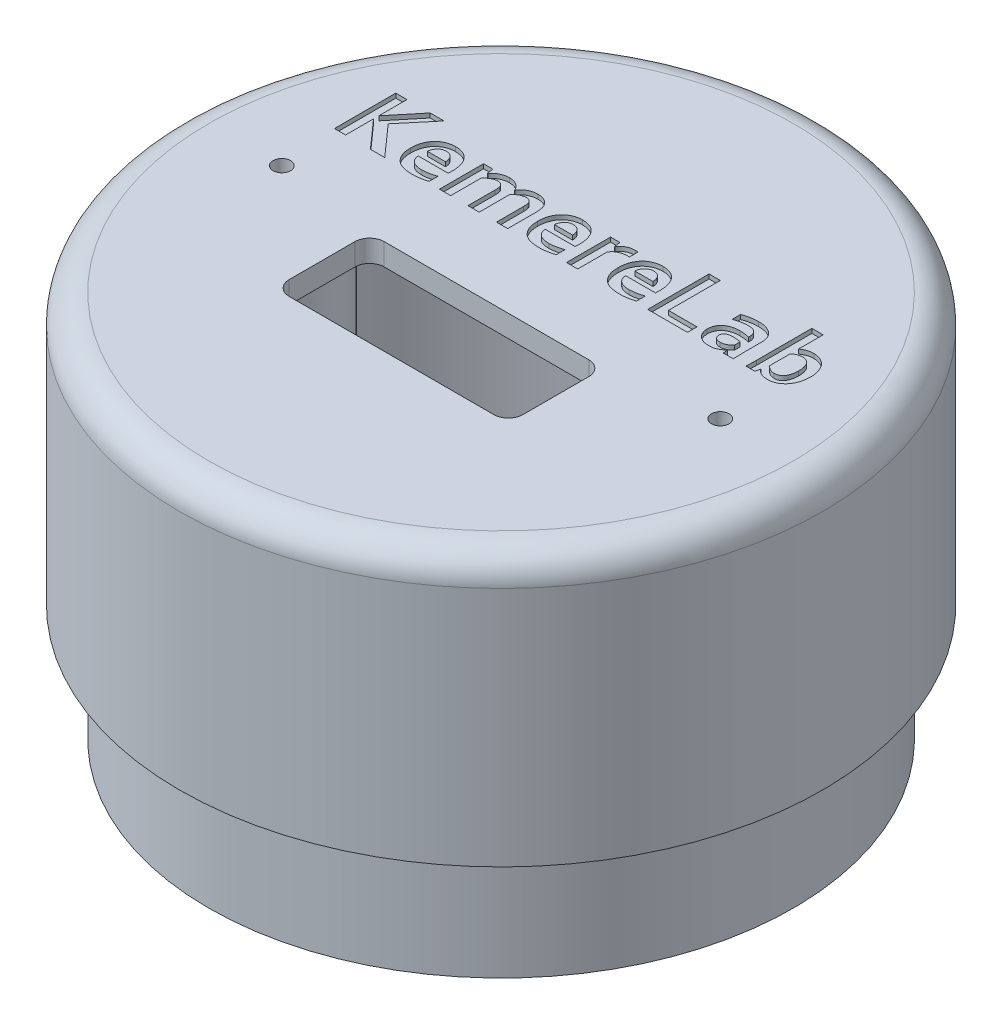
from build123d import *

# Parameters (mm, degrees)
SKETCH1_R               = 22
BOSS_EXTRUDE1_DEPTH     = 1.5
BOSS_EXTRUDE4_START     = -17
SKETCH1_15_R            = 22
SKETCH1_15_R_2          = 20.5
SKETCH1_15_R_3          = 20
BOSS_EXTRUDE4_DEPTH     = 17
BOSS_EXTRUDE5_START     = -25
SKETCH1_16_R            = 20
BOSS_EXTRUDE5_DEPTH     = 25
BOSS_EXTRUDE7_START     = -10
SKETCH1_18_R            = 3.6
BOSS_EXTRUDE7_DEPTH     = 10
SKETCH1_19_R            = 2.15
SKETCH1_19_R_2          = 0.6
CUT_EXTRUDE3_DEPTH      = 10
CUT_EXTRUDE4_DEPTH      = 10
CUT_EXTRUDE4_DEPTH_BACK = 10
SKETCH1_20_R            = 0.6
BOSS_EXTRUDE8_DEPTH     = 5
SKETCH1_22_W            = 16
SKETCH1_22_H            = 6.5
CUT_EXTRUDE6_DEPTH      = 5
FILLET13_R              = 1
FILLET14_R              = 2
CUT_EXTRUDE7_DEPTH      = 0.3


with BuildPart() as part:
    # Sketch1 → Boss-Extrude1 (new body)
    with BuildSketch(Plane(origin=(0, 0, 0), x_dir=(1, 0, 0), z_dir=(0, 1, 0))):
        with Locations(Location((0, 0, 0), (0, 0, 270))):
            Circle(SKETCH1_R)
    extrude(amount=BOSS_EXTRUDE1_DEPTH)

    # Sketch1<15> → Boss-Extrude4 (add)
    # profile 1 of 2: a face of its own
    with BuildSketch(Plane(origin=(0, 0, 0), x_dir=(1, 0, 0), z_dir=(0, 1, 0)).offset(BOSS_EXTRUDE4_START)):
        with Locations(Location((0, 0, 0), (0, 0, 270))):
            Circle(SKETCH1_15_R)
        Circle(SKETCH1_15_R_2, mode=Mode.SUBTRACT)
    # profile 2 of 2: a face of its own
    with BuildSketch(Plane(origin=(0, 0, 0), x_dir=(1, 0, 0), z_dir=(0, 1, 0)).offset(BOSS_EXTRUDE4_START)):
        Circle(SKETCH1_15_R_2)
        with Locations(Location((0, 0, 0), (0, 0, 270))):
            Circle(SKETCH1_15_R_3, mode=Mode.SUBTRACT)
    extrude(amount=BOSS_EXTRUDE4_DEPTH)

    # Sketch1<16> → Boss-Extrude5 (add)
    with BuildSketch(Plane(origin=(0, 0, 0), x_dir=(1, 0, 0), z_dir=(0, 1, 0)).offset(BOSS_EXTRUDE5_START)):
        with Locations(Location((0, 0, 0), (0, 0, 270))):
            Circle(SKETCH1_16_R)
        with BuildLine():
            ThreePointArc((-18.476333333, 0.935471301), (0, 18.5), (18.476333333, 0.935471301))
            ThreePointArc((18.476333333, 0.935471301), (18.568949425, 0.471805044), (18.6, 0))
            ThreePointArc((18.6, 0), (18.568949425, -0.471805044), (18.476333333, -0.935471301))
            ThreePointArc((18.476333333, -0.935471301), (0, -18.5), (-18.476333333, -0.935471301))
            ThreePointArc((-18.476333333, -0.935471301), (-18.6, 0), (-18.476333333, 0.935471301))
        make_face(mode=Mode.SUBTRACT)
    extrude(amount=BOSS_EXTRUDE5_DEPTH)

    # Sketch1<18> → Boss-Extrude7 (add)
    with BuildSketch(Plane(origin=(0, 0, 0), x_dir=(1, 0, 0), z_dir=(0, 1, 0)).offset(BOSS_EXTRUDE7_START)):
        with Locations((-15, 0)):
            Circle(SKETCH1_18_R)
        with Locations((15, 0)):
            Circle(SKETCH1_18_R)
    extrude(amount=BOSS_EXTRUDE7_DEPTH)

    # Sketch1<19> → Cut-Extrude3 (cut)
    # profile 1 of 2: a face of its own
    with BuildSketch(Plane(origin=(0, 0, 0), x_dir=(1, 0, 0), z_dir=(0, 1, 0))):
        with Locations(Location((-15, 0, 0), (0, 0, 270))):
            Circle(SKETCH1_19_R)
        with Locations(Location((-15, 0, 0), (0, 0, 270))):
            Circle(SKETCH1_19_R_2, mode=Mode.SUBTRACT)
    # profile 2 of 2: a face of its own
    with BuildSketch(Plane(origin=(0, 0, 0), x_dir=(1, 0, 0), z_dir=(0, 1, 0))):
        with Locations(Location((15, 0, 0), (0, 0, 270))):
            Circle(SKETCH1_19_R)
        with Locations(Location((15, 0, 0), (0, 0, 270))):
            Circle(SKETCH1_19_R_2, mode=Mode.SUBTRACT)
    extrude(amount=-CUT_EXTRUDE3_DEPTH, mode=Mode.SUBTRACT)

    # Sketch1<20> → Cut-Extrude4 (cut, two sides: drawn at the far end of the back side and taken through both)
    with BuildSketch(Plane(origin=(0, 0, 0), x_dir=(1, 0, 0), z_dir=(0, 1, 0)).offset(-CUT_EXTRUDE4_DEPTH_BACK)):
        with Locations(Location((-15, 0, 0), (0, 0, 270))):
            Circle(SKETCH1_20_R)
        with Locations(Location((15, 0, 0), (0, 0, 270))):
            Circle(SKETCH1_20_R)
    extrude(amount=CUT_EXTRUDE4_DEPTH + CUT_EXTRUDE4_DEPTH_BACK, mode=Mode.SUBTRACT)

    # Sketch1<21> → Boss-Extrude8 (add)
    with BuildSketch(Plane(origin=(0, 0, 0), x_dir=(1, 0, 0), z_dir=(0, 1, 0))):
        Polygon((-14.5, -10.5), (-11, -10.5), (-11, -9.5), (-13.5, -9.5), (-13.5, -7.5), (-11, -7.5), (-11, -6.5), (-14.5, -6.5), align=None)
        Polygon((14.5, -10.5), (14.5, -6.5), (11, -6.5), (11, -7.5), (13.5, -7.5), (13.5, -9.5), (11, -9.5), (11, -10.5), align=None)
    extrude(amount=-BOSS_EXTRUDE8_DEPTH)

    # Sketch1<22> → Cut-Extrude6 (cut)
    with BuildSketch(Plane(origin=(0, 0, 0), x_dir=(1, 0, 0), z_dir=(0, 1, 0))):
        with Locations((0, -4.25)):
            Rectangle(SKETCH1_22_W, SKETCH1_22_H)
    extrude(amount=CUT_EXTRUDE6_DEPTH, mode=Mode.SUBTRACT)

    # Fillet13
    fillet13_edges = [part.edges().sort_by_distance(p)[0] for p in [
        (8, 0.75, 7.5),
        (8, 0.75, 1),
        (-8, 0.75, 1),
        (-8, 0.75, 7.5),
    ]]
    fillet(fillet13_edges, radius=FILLET13_R)

    # Fillet14
    fillet14_edges = [part.edges().sort_by_distance(p)[0] for p in [
        (0, 1.5, -22),
    ]]
    fillet(fillet14_edges, radius=FILLET14_R)

    # Sketch2 → Cut-Extrude7 (cut)
    # profile 1 of 9: a face of its own
    with BuildSketch(Plane(origin=(0, 1.5, 0), x_dir=(1, 0, 0), z_dir=(0, 1, 0))):
        Polygon((-15.401176861, 4), (-15.401176861, 8.19750434), (-14.637238461, 8.19750434), (-14.637238461, 6.287196467), (-14.625229756, 6.287196467), (-13.050241882, 8.19750434), (-12.102477917, 8.19750434), (-13.841892678, 6.117227101), (-11.959297202, 4), (-12.938468549, 4), (-14.625229756, 5.894604182), (-14.637238461, 5.894604182), (-14.637238461, 4), align=None)
    # profile 2 of 9: a face of its own
    with BuildSketch(Plane(origin=(0, 1.5, 0), x_dir=(1, 0, 0), z_dir=(0, 1, 0))):
        with BuildLine():
            add(Edge.make_bspline(
                [(-9.95199594, 4.532078015), (-9.878590488, 4.534641261), (-9.727963834, 4.539900995), (-9.498948531, 4.575914763), (-9.264099316, 4.631995332), (-9.108283621, 4.68335905), (-9.029173133, 4.709437353)],
                knots=[0, 0, 0, 0, 0.933159656, 1.914826641, 2.94131921, 4, 4, 4, 4], degree=3))
            Line((-9.029173133, 4.709437353), (-9.029173133, 4.116392066))
            add(Edge.make_bspline(
                [(-9.029173133, 4.116392066), (-9.056103527, 4.105447151), (-9.115188608, 4.081434089), (-9.216443253, 4.0532037), (-9.33589988, 4.023688927), (-9.47207486, 3.99579615), (-9.618887603, 3.970810146), (-9.771224633, 3.953511204), (-9.926294385, 3.94317762), (-10.03049854, 3.941651559), (-10.083167951, 3.940880221)],
                knots=[0, 0, 0, 0, 0.649072356, 1.42405985, 2.345178503, 3.399010472, 4.528969603, 5.671696567, 6.823171966, 8, 8, 8, 8], degree=3))
            add(Edge.make_bspline(
                [(-10.083167951, 3.940880221), (-10.135848562, 3.942104285), (-10.240181294, 3.944528518), (-10.394960435, 3.959051984), (-10.54536414, 3.985544169), (-10.691340571, 4.019520563), (-10.830273401, 4.066386011), (-10.960068641, 4.126490561), (-11.080022269, 4.199262472), (-11.191210251, 4.283153601), (-11.290242569, 4.382387726), (-11.379833707, 4.493795913), (-11.457164284, 4.619472404), (-11.524416877, 4.758046819), (-11.578167684, 4.91162785), (-11.616409026, 5.080459479), (-11.639771451, 5.264570111), (-11.642144691, 5.39232115), (-11.64337588, 5.458595808)],
                knots=[0, 0, 0, 0, 1.019515307, 2.019126456, 3.004572719, 3.972846608, 4.916855263, 5.836556815, 6.734776173, 7.627385136, 8.524813633, 9.440472351, 10.387859717, 11.373882244, 12.415991142, 13.528922813, 14.718055086, 16, 16, 16, 16], degree=3))
            add(Edge.make_bspline(
                [(-11.64337588, 5.458595808), (-11.642181076, 5.524267046), (-11.639862017, 5.651731802), (-11.615546912, 5.836406772), (-11.580130971, 6.008911232), (-11.526551623, 6.167943311), (-11.460874389, 6.313907763), (-11.385385178, 6.4476624), (-11.29893877, 6.56786192), (-11.202171476, 6.674623358), (-11.096832235, 6.768983475), (-10.983703159, 6.85053568), (-10.863348678, 6.919756071), (-10.736067159, 6.975422717), (-10.604407082, 7.019842297), (-10.469869633, 7.05131668), (-10.333430548, 7.070287408), (-10.241803359, 7.072912441), (-10.195865031, 7.074228531)],
                knots=[0, 0, 0, 0, 1.293036685, 2.509722834, 3.663854691, 4.757307375, 5.808111949, 6.813365014, 7.778081174, 8.71867344, 9.646641585, 10.55917384, 11.461343563, 12.376634088, 13.291683345, 14.19515743, 15.095121755, 16, 16, 16, 16], degree=3))
            add(Edge.make_bspline(
                [(-10.195865031, 7.074228531), (-10.148090098, 7.073194637), (-10.054090302, 7.071160394), (-9.916212892, 7.054216426), (-9.784245641, 7.026446668), (-9.658274653, 6.988159805), (-9.539457115, 6.936870865), (-9.427503843, 6.874526439), (-9.325684429, 6.796660565), (-9.231606394, 6.707375087), (-9.145915728, 6.605294017), (-9.071278615, 6.488912731), (-9.006108389, 6.359262947), (-8.952114327, 6.215837165), (-8.908595345, 6.058850087), (-8.877495332, 5.888240691), (-8.859160446, 5.703790496), (-8.856753345, 5.576262509), (-8.855508781, 5.510325615)],
                knots=[0, 0, 0, 0, 0.978057297, 1.924381311, 2.839500968, 3.736985933, 4.615419739, 5.485097531, 6.353974945, 7.23258977, 8.136783016, 9.075958971, 10.057262806, 11.102996691, 12.209037648, 13.388858102, 14.64993882, 16, 16, 16, 16], degree=3))
            add(Edge.make_bspline(
                [(-8.855508781, 5.510325615), (-8.85647948, 5.461665775), (-8.858267854, 5.372016909), (-8.862713582, 5.282461612), (-8.864746247, 5.241515368)],
                knots=[0, 0, 0, 0, 1.085565117, 2, 2, 2, 2], degree=3))
            Line((-8.864746247, 5.241515368), (-10.90899737, 5.241515368))
            add(Edge.make_bspline(
                [(-10.90899737, 5.241515368), (-10.905621601, 5.210624432), (-10.899086824, 5.150826105), (-10.879251811, 5.065147136), (-10.852860551, 4.985819752), (-10.817532098, 4.913794127), (-10.775632564, 4.8484229), (-10.727318353, 4.789719965), (-10.672460463, 4.73795329), (-10.612124148, 4.692242433), (-10.545591403, 4.653711286), (-10.474638241, 4.618996393), (-10.397583106, 4.591788144), (-10.28699397, 4.561751301), (-10.13770951, 4.538013245), (-10.015212512, 4.534098357), (-9.95199594, 4.532078015)],
                knots=[0, 0, 0, 0, 0.977260723, 1.891770352, 2.762133371, 3.602969039, 4.409426027, 5.201073598, 5.989392406, 6.77824714, 7.577686241, 8.40557741, 9.260865004, 10.144825759, 12.010474535, 14, 14, 14, 14], degree=3))
        make_face()
        with BuildLine():
            add(Edge.make_bspline(
                [(-10.219882441, 6.483030737), (-10.243643274, 6.482712657), (-10.290167648, 6.482089848), (-10.357735708, 6.470926606), (-10.422013902, 6.456268214), (-10.499770548, 6.424727557), (-10.589727982, 6.37530872), (-10.681050598, 6.293961008), (-10.75678147, 6.197034044), (-10.813695104, 6.08507922), (-10.853380878, 5.962239164), (-10.867593361, 5.876368406), (-10.874818748, 5.832713163)],
                knots=[0, 0, 0, 0, 0.698993819, 1.368649395, 2.013262199, 2.636523611, 3.834783313, 5.017491762, 6.21324245, 7.438460173, 8.697756392, 10, 10, 10, 10], degree=3))
            Line((-10.874818748, 5.832713163), (-9.633303379, 5.832713163))
            add(Edge.make_bspline(
                [(-9.633303379, 5.832713163), (-9.634887548, 5.876310344), (-9.6379913, 5.961727292), (-9.667849135, 6.084175177), (-9.713011738, 6.196380652), (-9.778674045, 6.293929619), (-9.861940962, 6.375437003), (-9.946719886, 6.425215369), (-10.021159833, 6.456045085), (-10.083494497, 6.47119392), (-10.149907735, 6.482093595), (-10.196123523, 6.482712543), (-10.219882441, 6.483030737)],
                knots=[0, 0, 0, 0, 1.324755174, 2.595501408, 3.813846637, 4.988738847, 6.148621013, 7.329962067, 7.956478103, 8.595211867, 9.277817249, 10, 10, 10, 10], degree=3))
        make_face(mode=Mode.SUBTRACT)
    # profile 3 of 9: a face of its own
    with BuildSketch(Plane(origin=(0, 1.5, 0), x_dir=(1, 0, 0), z_dir=(0, 1, 0))):
        with BuildLine():
            add(Edge.make_bspline(
                [(-4.31252323, 5.844721868), (-4.31291663, 5.876137944), (-4.313673017, 5.936541447), (-4.318317105, 6.023433636), (-4.325372501, 6.102044331), (-4.335514389, 6.150853886), (-4.340235626, 6.173575641)],
                knots=[0, 0, 0, 0, 1.140091438, 2.19204704, 3.158364291, 4, 4, 4, 4], degree=3))
            add(Edge.make_bspline(
                [(-4.340235626, 6.173575641), (-4.346334804, 6.195672407), (-4.358269126, 6.238909373), (-4.387271418, 6.298632134), (-4.424926521, 6.351219423), (-4.47039217, 6.397023317), (-4.525192219, 6.43488995), (-4.589994252, 6.46281325), (-4.665228466, 6.479158595), (-4.718580885, 6.481694799), (-4.74668411, 6.483030737)],
                knots=[0, 0, 0, 0, 0.986922707, 1.931121579, 2.84486202, 3.764947291, 4.7004238, 5.699419405, 6.788176135, 8, 8, 8, 8], degree=3))
            add(Edge.make_bspline(
                [(-4.74668411, 6.483030737), (-4.778828757, 6.48154652), (-4.844767183, 6.478501942), (-4.944019537, 6.45476296), (-5.044160854, 6.418693297), (-5.143964085, 6.370591091), (-5.241138965, 6.310558423), (-5.333028207, 6.238311284), (-5.419234201, 6.156691408), (-5.469667847, 6.09530721), (-5.494918818, 6.064573548)],
                knots=[0, 0, 0, 0, 0.871304381, 1.787309694, 2.754340383, 3.75561593, 4.78716614, 5.846547879, 6.921815836, 8, 8, 8, 8], degree=3))
            Line((-5.494918818, 6.064573548), (-5.494918818, 4))
            Line((-5.494918818, 4), (-6.263475951, 4))
            Line((-6.263475951, 4), (-6.263475951, 5.844721868))
            add(Edge.make_bspline(
                [(-6.263475951, 5.844721868), (-6.263869351, 5.876137944), (-6.264625739, 5.936541447), (-6.269269827, 6.023433636), (-6.276325223, 6.102044331), (-6.28646711, 6.150853886), (-6.291188348, 6.173575641)],
                knots=[0, 0, 0, 0, 1.140091438, 2.19204704, 3.158364291, 4, 4, 4, 4], degree=3))
            add(Edge.make_bspline(
                [(-6.291188348, 6.173575641), (-6.297291547, 6.19566841), (-6.309233737, 6.238897553), (-6.338179574, 6.298676432), (-6.375913758, 6.350882457), (-6.420417778, 6.397328913), (-6.475274269, 6.434837359), (-6.540007275, 6.462828224), (-6.615564058, 6.479223318), (-6.669225517, 6.481712714), (-6.697636831, 6.483030737)],
                knots=[0, 0, 0, 0, 0.986441989, 1.930180952, 2.843476322, 3.753777748, 4.688798598, 5.687307604, 6.775534014, 8, 8, 8, 8], degree=3))
            add(Edge.make_bspline(
                [(-6.697636831, 6.483030737), (-6.729781479, 6.48154652), (-6.795719904, 6.478501942), (-6.894972259, 6.45476296), (-6.995113575, 6.418693297), (-7.094916807, 6.370591091), (-7.192091687, 6.310558423), (-7.283980929, 6.238311284), (-7.370186922, 6.156691408), (-7.420620568, 6.09530721), (-7.44587154, 6.064573548)],
                knots=[0, 0, 0, 0, 0.871304381, 1.787309694, 2.754340383, 3.75561593, 4.78716614, 5.846547879, 6.921815836, 8, 8, 8, 8], degree=3))
            Line((-7.44587154, 6.064573548), (-7.44587154, 4))
            Line((-7.44587154, 4), (-8.214428673, 4))
            Line((-8.214428673, 4), (-8.214428673, 7.015108751))
            Line((-8.214428673, 7.015108751), (-7.577043551, 7.015108751))
            Line((-7.577043551, 7.015108751), (-7.504991319, 6.581871618))
            Line((-7.504991319, 6.581871618), (-7.492058868, 6.581871618))
            add(Edge.make_bspline(
                [(-7.492058868, 6.581871618), (-7.468143691, 6.613284293), (-7.418214432, 6.678866563), (-7.326359178, 6.767843791), (-7.220896125, 6.852364731), (-7.099696125, 6.924921407), (-6.966614494, 6.987338743), (-6.820935458, 7.034704041), (-6.665043835, 7.069374953), (-6.556807822, 7.072593085), (-6.501802562, 7.074228531)],
                knots=[0, 0, 0, 0, 0.825362771, 1.723163131, 2.668317557, 3.648741736, 4.672361209, 5.73828323, 6.850601432, 8, 8, 8, 8], degree=3))
            add(Edge.make_bspline(
                [(-6.501802562, 7.074228531), (-6.453038757, 7.072694923), (-6.357009042, 7.069674815), (-6.21740679, 7.044000165), (-6.084848979, 7.003326687), (-5.961297053, 6.945111709), (-5.846948157, 6.870693863), (-5.748094495, 6.775208687), (-5.662283237, 6.662447178), (-5.620055827, 6.576242421), (-5.598378432, 6.531989304)],
                knots=[0, 0, 0, 0, 1.045121926, 2.058140491, 3.033588118, 4.011447128, 4.978542859, 5.945458187, 6.945303224, 8, 8, 8, 8], degree=3))
            Line((-5.598378432, 6.531989304), (-5.585445981, 6.531989304))
            add(Edge.make_bspline(
                [(-5.585445981, 6.531989304), (-5.555456341, 6.571160587), (-5.495791776, 6.649092085), (-5.392167322, 6.753687421), (-5.278603991, 6.847275573), (-5.151633984, 6.924743262), (-5.014823701, 6.98874166), (-4.867430227, 7.037109582), (-4.709535941, 7.068881131), (-4.600272789, 7.072418918), (-4.544383615, 7.074228531)],
                knots=[0, 0, 0, 0, 0.969446156, 1.928718858, 2.888736821, 3.856801122, 4.845724286, 5.853074862, 6.901826731, 8, 8, 8, 8], degree=3))
            add(Edge.make_bspline(
                [(-4.544383615, 7.074228531), (-4.492222298, 7.072478365), (-4.391531293, 7.069099885), (-4.247535039, 7.042659066), (-4.116176414, 7.001675119), (-3.998769387, 6.942457794), (-3.894195897, 6.870074362), (-3.800933034, 6.786159651), (-3.721838522, 6.688590154), (-3.680325595, 6.615754544), (-3.659434416, 6.579100378)],
                knots=[0, 0, 0, 0, 1.169792562, 2.258140642, 3.274251855, 4.247646018, 5.196399581, 6.12088876, 7.054346412, 8, 8, 8, 8], degree=3))
            add(Edge.make_bspline(
                [(-3.659434416, 6.579100378), (-3.649470021, 6.558646992), (-3.629046166, 6.51672403), (-3.6056003, 6.448360646), (-3.584717209, 6.373870299), (-3.56965341, 6.291250283), (-3.557579466, 6.200007737), (-3.549454371, 6.098573028), (-3.545095914, 5.984246755), (-3.544359478, 5.903537721), (-3.543966097, 5.860425559)],
                knots=[0, 0, 0, 0, 0.742658963, 1.522215615, 2.356879469, 3.268392232, 4.262893005, 5.363147306, 6.591478364, 8, 8, 8, 8], degree=3))
            Line((-3.543966097, 5.860425559), (-3.543966097, 4))
            Line((-3.543966097, 4), (-4.31252323, 4))
            Line((-4.31252323, 4), (-4.31252323, 5.844721868))
        make_face()
    # profile 4 of 9: a face of its own
    with BuildSketch(Plane(origin=(0, 1.5, 0), x_dir=(1, 0, 0), z_dir=(0, 1, 0))):
        with BuildLine():
            add(Edge.make_bspline(
                [(-1.261388363, 4.532078015), (-1.18798291, 4.534641261), (-1.037356257, 4.539900995), (-0.808340953, 4.575914763), (-0.573491738, 4.631995332), (-0.417676044, 4.68335905), (-0.338565555, 4.709437353)],
                knots=[0, 0, 0, 0, 0.933159656, 1.914826641, 2.94131921, 4, 4, 4, 4], degree=3))
            Line((-0.338565555, 4.709437353), (-0.338565555, 4.116392066))
            add(Edge.make_bspline(
                [(-0.338565555, 4.116392066), (-0.365495949, 4.105447151), (-0.424581031, 4.081434089), (-0.525835676, 4.0532037), (-0.645292302, 4.023688927), (-0.781467283, 3.99579615), (-0.928280026, 3.970810146), (-1.080617055, 3.953511204), (-1.235686807, 3.94317762), (-1.339890962, 3.941651559), (-1.392560373, 3.940880221)],
                knots=[0, 0, 0, 0, 0.649072356, 1.42405985, 2.345178503, 3.399010472, 4.528969603, 5.671696567, 6.823171966, 8, 8, 8, 8], degree=3))
            add(Edge.make_bspline(
                [(-1.392560373, 3.940880221), (-1.445240985, 3.942104285), (-1.549573716, 3.944528518), (-1.704352858, 3.959051984), (-1.854756562, 3.985544169), (-2.000732993, 4.019520563), (-2.139665823, 4.066386011), (-2.269461064, 4.126490561), (-2.389414691, 4.199262472), (-2.500602673, 4.283153601), (-2.599634991, 4.382387726), (-2.689226129, 4.493795913), (-2.766556706, 4.619472404), (-2.8338093, 4.758046819), (-2.887560106, 4.91162785), (-2.925801448, 5.080459479), (-2.949163873, 5.264570111), (-2.951537114, 5.39232115), (-2.952768303, 5.458595808)],
                knots=[0, 0, 0, 0, 1.019515307, 2.019126456, 3.004572719, 3.972846608, 4.916855263, 5.836556815, 6.734776173, 7.627385136, 8.524813633, 9.440472351, 10.387859717, 11.373882244, 12.415991142, 13.528922813, 14.718055086, 16, 16, 16, 16], degree=3))
            add(Edge.make_bspline(
                [(-2.952768303, 5.458595808), (-2.951573498, 5.524267046), (-2.94925444, 5.651731802), (-2.924939335, 5.836406772), (-2.889523393, 6.008911232), (-2.835944045, 6.167943311), (-2.770266811, 6.313907763), (-2.6947776, 6.4476624), (-2.608331192, 6.56786192), (-2.511563898, 6.674623358), (-2.406224657, 6.768983475), (-2.293095582, 6.85053568), (-2.1727411, 6.919756071), (-2.045459581, 6.975422717), (-1.913799504, 7.019842297), (-1.779262055, 7.05131668), (-1.64282297, 7.070287408), (-1.551195781, 7.072912441), (-1.505257453, 7.074228531)],
                knots=[0, 0, 0, 0, 1.293036685, 2.509722834, 3.663854691, 4.757307375, 5.808111949, 6.813365014, 7.778081174, 8.71867344, 9.646641585, 10.55917384, 11.461343563, 12.376634088, 13.291683345, 14.19515743, 15.095121755, 16, 16, 16, 16], degree=3))
            add(Edge.make_bspline(
                [(-1.505257453, 7.074228531), (-1.457482521, 7.073194637), (-1.363482725, 7.071160394), (-1.225605315, 7.054216426), (-1.093638064, 7.026446668), (-0.967667075, 6.988159805), (-0.848849538, 6.936870865), (-0.736896265, 6.874526439), (-0.635076851, 6.796660565), (-0.540998816, 6.707375087), (-0.45530815, 6.605294017), (-0.380671037, 6.488912731), (-0.315500811, 6.359262947), (-0.261506749, 6.215837165), (-0.217987767, 6.058850087), (-0.186887754, 5.888240691), (-0.168552868, 5.703790496), (-0.166145767, 5.576262509), (-0.164901203, 5.510325615)],
                knots=[0, 0, 0, 0, 0.978057297, 1.924381311, 2.839500968, 3.736985933, 4.615419739, 5.485097531, 6.353974945, 7.23258977, 8.136783016, 9.075958971, 10.057262806, 11.102996691, 12.209037648, 13.388858102, 14.64993882, 16, 16, 16, 16], degree=3))
            add(Edge.make_bspline(
                [(-0.164901203, 5.510325615), (-0.165871902, 5.461665775), (-0.167660276, 5.372016909), (-0.172106004, 5.282461612), (-0.174138669, 5.241515368)],
                knots=[0, 0, 0, 0, 1.085565117, 2, 2, 2, 2], degree=3))
            Line((-0.174138669, 5.241515368), (-2.218389792, 5.241515368))
            add(Edge.make_bspline(
                [(-2.218389792, 5.241515368), (-2.215014023, 5.210624432), (-2.208479246, 5.150826105), (-2.188644233, 5.065147136), (-2.162252974, 4.985819752), (-2.12692452, 4.913794127), (-2.085024987, 4.8484229), (-2.036710775, 4.789719965), (-1.981852885, 4.73795329), (-1.921516571, 4.692242433), (-1.854983825, 4.653711286), (-1.784030663, 4.618996393), (-1.706975528, 4.591788144), (-1.596386392, 4.561751301), (-1.447101932, 4.538013245), (-1.324604934, 4.534098357), (-1.261388363, 4.532078015)],
                knots=[0, 0, 0, 0, 0.977260723, 1.891770352, 2.762133371, 3.602969039, 4.409426027, 5.201073598, 5.989392406, 6.77824714, 7.577686241, 8.40557741, 9.260865004, 10.144825759, 12.010474535, 14, 14, 14, 14], degree=3))
        make_face()
        with BuildLine():
            add(Edge.make_bspline(
                [(-1.529274863, 6.483030737), (-1.553035696, 6.482712657), (-1.599560071, 6.482089848), (-1.667128131, 6.470926606), (-1.731406324, 6.456268214), (-1.809162971, 6.424727557), (-1.899120404, 6.37530872), (-1.990443021, 6.293961008), (-2.066173893, 6.197034044), (-2.123087526, 6.08507922), (-2.162773301, 5.962239164), (-2.176985783, 5.876368406), (-2.18421117, 5.832713163)],
                knots=[0, 0, 0, 0, 0.698993819, 1.368649395, 2.013262199, 2.636523611, 3.834783313, 5.017491762, 6.21324245, 7.438460173, 8.697756392, 10, 10, 10, 10], degree=3))
            Line((-2.18421117, 5.832713163), (-0.942695802, 5.832713163))
            add(Edge.make_bspline(
                [(-0.942695802, 5.832713163), (-0.94427997, 5.876310344), (-0.947383723, 5.961727292), (-0.977241557, 6.084175177), (-1.02240416, 6.196380652), (-1.088066468, 6.293929619), (-1.171333384, 6.375437003), (-1.256112308, 6.425215369), (-1.330552255, 6.456045085), (-1.392886919, 6.47119392), (-1.459300157, 6.482093595), (-1.505515946, 6.482712543), (-1.529274863, 6.483030737)],
                knots=[0, 0, 0, 0, 1.324755174, 2.595501408, 3.813846637, 4.988738847, 6.148621013, 7.329962067, 7.956478103, 8.595211867, 9.277817249, 10, 10, 10, 10], degree=3))
        make_face(mode=Mode.SUBTRACT)
    # profile 5 of 9: a face of its own
    with BuildSketch(Plane(origin=(0, 1.5, 0), x_dir=(1, 0, 0), z_dir=(0, 1, 0))):
        with BuildLine():
            Line((2.301502095, 6.483030737), (2.23868733, 6.483030737))
            add(Edge.make_bspline(
                [(2.23868733, 6.483030737), (2.183790589, 6.481727885), (2.076912927, 6.479191384), (1.921953637, 6.456166415), (1.776500181, 6.42105514), (1.642641585, 6.369037002), (1.519933557, 6.304074352), (1.412555591, 6.221233891), (1.318118925, 6.123845406), (1.269370049, 6.047651445), (1.244736038, 6.009148754)],
                knots=[0, 0, 0, 0, 1.140289476, 2.220012902, 3.249085462, 4.243836459, 5.197407337, 6.124121478, 7.05207224, 8, 8, 8, 8], degree=3))
            Line((1.244736038, 6.009148754), (1.244736038, 4))
            Line((1.244736038, 4), (0.476178905, 4))
            Line((0.476178905, 4), (0.476178905, 7.015108751))
            Line((0.476178905, 7.015108751), (1.113564027, 7.015108751))
            Line((1.113564027, 7.015108751), (1.185616258, 6.581871618))
            Line((1.185616258, 6.581871618), (1.197624964, 6.581871618))
            add(Edge.make_bspline(
                [(1.197624964, 6.581871618), (1.220739519, 6.618534417), (1.266694039, 6.691424475), (1.351229547, 6.788910103), (1.449041795, 6.872678505), (1.55739744, 6.945255234), (1.678090916, 7.004475391), (1.811781861, 7.044063626), (1.956247888, 7.070013483), (2.056588196, 7.072792482), (2.108439066, 7.074228531)],
                knots=[0, 0, 0, 0, 0.955464455, 1.89957838, 2.834107643, 3.789572098, 4.771159717, 5.787775391, 6.856832598, 8, 8, 8, 8], degree=3))
            add(Edge.make_bspline(
                [(2.108439066, 7.074228531), (2.143271215, 7.073932188), (2.207814567, 7.073383071), (2.271969632, 7.066371298), (2.301502095, 7.063143572)],
                knots=[0, 0, 0, 0, 1.079341177, 2, 2, 2, 2], degree=3))
            Line((2.301502095, 7.063143572), (2.301502095, 6.483030737))
        make_face()
    # profile 6 of 9: a face of its own
    with BuildSketch(Plane(origin=(0, 1.5, 0), x_dir=(1, 0, 0), z_dir=(0, 1, 0))):
        with BuildLine():
            add(Edge.make_bspline(
                [(4.236751125, 4.532078015), (4.310156578, 4.534641261), (4.460783231, 4.539900995), (4.689798535, 4.575914763), (4.92464775, 4.631995332), (5.080463444, 4.68335905), (5.159573933, 4.709437353)],
                knots=[0, 0, 0, 0, 0.933159656, 1.914826641, 2.94131921, 4, 4, 4, 4], degree=3))
            Line((5.159573933, 4.709437353), (5.159573933, 4.116392066))
            add(Edge.make_bspline(
                [(5.159573933, 4.116392066), (5.132643539, 4.105447151), (5.073558457, 4.081434089), (4.972303812, 4.0532037), (4.852847186, 4.023688927), (4.716672205, 3.99579615), (4.569859462, 3.970810146), (4.417522433, 3.953511204), (4.262452681, 3.94317762), (4.158248526, 3.941651559), (4.105579115, 3.940880221)],
                knots=[0, 0, 0, 0, 0.649072356, 1.42405985, 2.345178503, 3.399010472, 4.528969603, 5.671696567, 6.823171966, 8, 8, 8, 8], degree=3))
            add(Edge.make_bspline(
                [(4.105579115, 3.940880221), (4.052898503, 3.942104285), (3.948565772, 3.944528518), (3.79378663, 3.959051984), (3.643382926, 3.985544169), (3.497406495, 4.019520563), (3.358473665, 4.066386011), (3.228678424, 4.126490561), (3.108724797, 4.199262472), (2.997536814, 4.283153601), (2.898504497, 4.382387726), (2.808913359, 4.493795913), (2.731582782, 4.619472404), (2.664330188, 4.758046819), (2.610579382, 4.91162785), (2.57233804, 5.080459479), (2.548975615, 5.264570111), (2.546602374, 5.39232115), (2.545371185, 5.458595808)],
                knots=[0, 0, 0, 0, 1.019515307, 2.019126456, 3.004572719, 3.972846608, 4.916855263, 5.836556815, 6.734776173, 7.627385136, 8.524813633, 9.440472351, 10.387859717, 11.373882244, 12.415991142, 13.528922813, 14.718055086, 16, 16, 16, 16], degree=3))
            add(Edge.make_bspline(
                [(2.545371185, 5.458595808), (2.54656599, 5.524267046), (2.548885048, 5.651731802), (2.573200153, 5.836406772), (2.608616095, 6.008911232), (2.662195443, 6.167943311), (2.727872677, 6.313907763), (2.803361888, 6.4476624), (2.889808296, 6.56786192), (2.98657559, 6.674623358), (3.091914831, 6.768983475), (3.205043906, 6.85053568), (3.325398387, 6.919756071), (3.452679907, 6.975422717), (3.584339984, 7.019842297), (3.718877433, 7.05131668), (3.855316518, 7.070287408), (3.946943707, 7.072912441), (3.992882035, 7.074228531)],
                knots=[0, 0, 0, 0, 1.293036685, 2.509722834, 3.663854691, 4.757307375, 5.808111949, 6.813365014, 7.778081174, 8.71867344, 9.646641585, 10.55917384, 11.461343563, 12.376634088, 13.291683345, 14.19515743, 15.095121755, 16, 16, 16, 16], degree=3))
            add(Edge.make_bspline(
                [(3.992882035, 7.074228531), (4.040656967, 7.073194637), (4.134656763, 7.071160394), (4.272534173, 7.054216426), (4.404501424, 7.026446668), (4.530472413, 6.988159805), (4.64928995, 6.936870865), (4.761243223, 6.874526439), (4.863062637, 6.796660565), (4.957140672, 6.707375087), (5.042831338, 6.605294017), (5.11746845, 6.488912731), (5.182638677, 6.359262947), (5.236632738, 6.215837165), (5.280151721, 6.058850087), (5.311251734, 5.888240691), (5.32958662, 5.703790496), (5.331993721, 5.576262509), (5.333238285, 5.510325615)],
                knots=[0, 0, 0, 0, 0.978057297, 1.924381311, 2.839500968, 3.736985933, 4.615419739, 5.485097531, 6.353974945, 7.23258977, 8.136783016, 9.075958971, 10.057262806, 11.102996691, 12.209037648, 13.388858102, 14.64993882, 16, 16, 16, 16], degree=3))
            add(Edge.make_bspline(
                [(5.333238285, 5.510325615), (5.332267586, 5.461665775), (5.330479212, 5.372016909), (5.326033484, 5.282461612), (5.324000819, 5.241515368)],
                knots=[0, 0, 0, 0, 1.085565117, 2, 2, 2, 2], degree=3))
            Line((5.324000819, 5.241515368), (3.279749696, 5.241515368))
            add(Edge.make_bspline(
                [(3.279749696, 5.241515368), (3.283125465, 5.210624432), (3.289660242, 5.150826105), (3.309495255, 5.065147136), (3.335886514, 4.985819752), (3.371214968, 4.913794127), (3.413114501, 4.8484229), (3.461428713, 4.789719965), (3.516286603, 4.73795329), (3.576622917, 4.692242433), (3.643155663, 4.653711286), (3.714108825, 4.618996393), (3.79116396, 4.591788144), (3.901753096, 4.561751301), (4.051037556, 4.538013245), (4.173534554, 4.534098357), (4.236751125, 4.532078015)],
                knots=[0, 0, 0, 0, 0.977260723, 1.891770352, 2.762133371, 3.602969039, 4.409426027, 5.201073598, 5.989392406, 6.77824714, 7.577686241, 8.40557741, 9.260865004, 10.144825759, 12.010474535, 14, 14, 14, 14], degree=3))
        make_face()
        with BuildLine():
            add(Edge.make_bspline(
                [(3.968864625, 6.483030737), (3.945103792, 6.482712657), (3.898579417, 6.482089848), (3.831011357, 6.470926606), (3.766733164, 6.456268214), (3.688976517, 6.424727557), (3.599019084, 6.37530872), (3.507696467, 6.293961008), (3.431965595, 6.197034044), (3.375051962, 6.08507922), (3.335366187, 5.962239164), (3.321153705, 5.876368406), (3.313928318, 5.832713163)],
                knots=[0, 0, 0, 0, 0.698993819, 1.368649395, 2.013262199, 2.636523611, 3.834783313, 5.017491762, 6.21324245, 7.438460173, 8.697756392, 10, 10, 10, 10], degree=3))
            Line((3.313928318, 5.832713163), (4.555443686, 5.832713163))
            add(Edge.make_bspline(
                [(4.555443686, 5.832713163), (4.553859518, 5.876310344), (4.550755765, 5.961727292), (4.520897931, 6.084175177), (4.475735327, 6.196380652), (4.41007302, 6.293929619), (4.326806104, 6.375437003), (4.24202718, 6.425215369), (4.167587233, 6.456045085), (4.105252569, 6.47119392), (4.038839331, 6.482093595), (3.992623542, 6.482712543), (3.968864625, 6.483030737)],
                knots=[0, 0, 0, 0, 1.324755174, 2.595501408, 3.813846637, 4.988738847, 6.148621013, 7.329962067, 7.956478103, 8.595211867, 9.277817249, 10, 10, 10, 10], degree=3))
        make_face(mode=Mode.SUBTRACT)
    # profile 7 of 9: a face of its own
    with BuildSketch(Plane(origin=(0, 1.5, 0), x_dir=(1, 0, 0), z_dir=(0, 1, 0))):
        Polygon((6.801995305, 8.19750434), (6.801995305, 4.650317574), (8.753871773, 4.650317574), (8.753871773, 4), (6.033438172, 4), (6.033438172, 8.19750434), align=None)
    # profile 8 of 9: a face of its own
    with BuildSketch(Plane(origin=(0, 1.5, 0), x_dir=(1, 0, 0), z_dir=(0, 1, 0))):
        with BuildLine():
            Line((11.175935237, 4.321463801), (11.163002785, 4.321463801))
            add(Edge.make_bspline(
                [(11.163002785, 4.321463801), (11.140242059, 4.298932012), (11.091973165, 4.251148626), (11.009139595, 4.183795101), (10.913780901, 4.117212513), (10.806902761, 4.054008967), (10.686009994, 4.001807621), (10.552151091, 3.964830844), (10.406103747, 3.945416606), (10.305203071, 3.942424774), (10.25311243, 3.940880221)],
                knots=[0, 0, 0, 0, 0.755979855, 1.603213862, 2.517010976, 3.501015766, 4.530270744, 5.616997013, 6.769758955, 8, 8, 8, 8], degree=3))
            add(Edge.make_bspline(
                [(10.25311243, 3.940880221), (10.21703089, 3.941346227), (10.146161285, 3.942261536), (10.042030213, 3.956758052), (9.940887367, 3.974858076), (9.844403624, 4.004103769), (9.752340613, 4.039401133), (9.667770738, 4.084557677), (9.587883511, 4.134061107), (9.516202433, 4.192647885), (9.450933518, 4.257185215), (9.394467922, 4.329400528), (9.344205635, 4.407093843), (9.301884734, 4.491327614), (9.267079634, 4.581120146), (9.24374739, 4.676790121), (9.228104495, 4.777279504), (9.226649715, 4.846089469), (9.225906262, 4.881254212)],
                knots=[0, 0, 0, 0, 1.105750162, 2.171860625, 3.220335659, 4.254416825, 5.259446921, 6.239579928, 7.190749356, 8.137782837, 9.072823568, 10.000680781, 10.94389128, 11.90699157, 12.887579586, 13.890966131, 14.922196323, 16, 16, 16, 16], degree=3))
            add(Edge.make_bspline(
                [(9.225906262, 4.881254212), (9.22679231, 4.919828069), (9.228524585, 4.995242249), (9.247327169, 5.104969131), (9.27407074, 5.209236577), (9.314505526, 5.306595975), (9.364439561, 5.397134201), (9.42319638, 5.481121277), (9.490519254, 5.55822097), (9.568012361, 5.626657603), (9.65329934, 5.687655105), (9.746363386, 5.741557431), (9.847404254, 5.787895754), (9.956417315, 5.825451476), (10.072409303, 5.854567058), (10.194138928, 5.87742786), (10.322487819, 5.888731534), (10.409824258, 5.890783528), (10.454489179, 5.891832942)],
                knots=[0, 0, 0, 0, 1.033114978, 2.019801135, 2.977002182, 3.913691711, 4.837413265, 5.744344911, 6.656857729, 7.57484355, 8.509566542, 9.463915375, 10.453911412, 11.485177649, 12.550382142, 13.657962296, 14.802253355, 16, 16, 16, 16], degree=3))
            add(Edge.make_bspline(
                [(10.454489179, 5.891832942), (10.518598997, 5.890727006), (10.641560898, 5.888605833), (10.817249237, 5.868914636), (10.974736929, 5.843621156), (11.072297367, 5.819163791), (11.117739204, 5.807772006)],
                knots=[0, 0, 0, 0, 1.147164143, 2.200247777, 3.161708893, 4, 4, 4, 4], degree=3))
            Line((11.117739204, 5.807772006), (11.117739204, 5.929706551))
            add(Edge.make_bspline(
                [(11.117739204, 5.929706551), (11.115885775, 5.964974184), (11.112189918, 6.035300121), (11.084754149, 6.137681424), (11.038858528, 6.234013311), (10.980687933, 6.303370234), (10.924913929, 6.352528929), (10.875144022, 6.384796282), (10.819609516, 6.413186535), (10.758274064, 6.438420523), (10.690568709, 6.458665321), (10.616091366, 6.473554118), (10.534415485, 6.481531972), (10.477599321, 6.482517636), (10.448022953, 6.483030737)],
                knots=[0, 0, 0, 0, 1.2907017, 2.573742502, 3.854947801, 5.16909031, 5.856624661, 6.572973392, 7.334678004, 8.138948297, 8.998865645, 9.919025338, 10.916722466, 12, 12, 12, 12], degree=3))
            add(Edge.make_bspline(
                [(10.448022953, 6.483030737), (10.373076673, 6.480907598), (10.222458334, 6.47664076), (10.034621557, 6.447278041), (9.882497005, 6.414032725), (9.7630382, 6.383211178), (9.638756952, 6.347595946), (9.554974691, 6.319826526), (9.512267694, 6.305671398)],
                knots=[0, 0, 0, 0, 1.40955292, 2.832755937, 3.567991617, 4.339428818, 5.153543854, 6, 6, 6, 6], degree=3))
            Line((9.512267694, 6.305671398), (9.512267694, 6.870080543))
            add(Edge.make_bspline(
                [(9.512267694, 6.870080543), (9.589896585, 6.90046898), (9.747155115, 6.962029063), (9.954247664, 7.012394372), (10.125475213, 7.042963398), (10.258248087, 7.060920844), (10.394304393, 7.070709519), (10.48588318, 7.073048523), (10.532083889, 7.074228531)],
                knots=[0, 0, 0, 0, 1.432543815, 2.902008936, 3.655191904, 4.42444026, 5.205143692, 6, 6, 6, 6], degree=3))
            add(Edge.make_bspline(
                [(10.532083889, 7.074228531), (10.585710901, 7.073599687), (10.68951995, 7.072382396), (10.840074427, 7.055678816), (10.980528361, 7.031760544), (11.110924017, 6.996366341), (11.230445638, 6.951884997), (11.341242781, 6.901377652), (11.440679496, 6.840992875), (11.530853189, 6.774401034), (11.611235185, 6.701381757), (11.679540729, 6.620584968), (11.737874546, 6.53366642), (11.784404528, 6.440252007), (11.821977064, 6.341997013), (11.847314146, 6.2389413), (11.863691387, 6.131913255), (11.865817211, 6.059092361), (11.866897659, 6.022081206)],
                knots=[0, 0, 0, 0, 1.344113118, 2.601881048, 3.79393715, 4.914075034, 5.984122856, 6.989385116, 7.962705058, 8.895485926, 9.797195663, 10.679116046, 11.542175489, 12.41584313, 13.290670159, 14.174616397, 15.072250401, 16, 16, 16, 16], degree=3))
            Line((11.866897659, 6.022081206), (11.866897659, 4.891415424))
            add(Edge.make_bspline(
                [(11.866897659, 4.891415424), (11.866709128, 4.843687139), (11.866345427, 4.751613461), (11.868861146, 4.618603465), (11.870221815, 4.496039003), (11.87407233, 4.350699562), (11.879448418, 4.186583765), (11.884103992, 4.059734343), (11.886296337, 4)],
                knots=[0, 0, 0, 0, 0.963426354, 1.858566839, 2.68534227, 3.437667516, 4.793378433, 6, 6, 6, 6], degree=3))
            Line((11.886296337, 4), (11.20734262, 4))
            Line((11.20734262, 4), (11.175935237, 4.321463801))
        make_face()
        with BuildLine():
            add(Edge.make_bspline(
                [(11.117739204, 5.244286608), (11.079290772, 5.251310203), (10.997401506, 5.266269384), (10.86839859, 5.284363906), (10.730651054, 5.297858128), (10.636499462, 5.29970859), (10.589356176, 5.300635148)],
                knots=[0, 0, 0, 0, 0.881324296, 1.877085611, 2.937021049, 4, 4, 4, 4], degree=3))
            add(Edge.make_bspline(
                [(10.589356176, 5.300635148), (10.545864233, 5.29946036), (10.463068991, 5.297223926), (10.346070603, 5.278814516), (10.242815491, 5.249147871), (10.154953997, 5.205702453), (10.082177829, 5.150554489), (10.030290854, 5.079395624), (9.999710919, 4.99474018), (9.996264982, 4.93416827), (9.994463395, 4.902500383)],
                knots=[0, 0, 0, 0, 1.293159788, 2.461777279, 3.513749995, 4.476428782, 5.363395535, 6.20252946, 7.060255929, 8, 8, 8, 8], degree=3))
            add(Edge.make_bspline(
                [(9.994463395, 4.902500383), (9.996141659, 4.873038832), (9.999364585, 4.816461074), (10.026607037, 4.737508557), (10.071625819, 4.673266512), (10.127278388, 4.619355297), (10.196097554, 4.580446493), (10.273363941, 4.551542643), (10.358361743, 4.535240831), (10.417166778, 4.533144878), (10.447099206, 4.532078015)],
                knots=[0, 0, 0, 0, 1.072515067, 2.059650435, 2.997003826, 3.910312396, 4.861549304, 5.856317276, 6.908841232, 8, 8, 8, 8], degree=3))
            add(Edge.make_bspline(
                [(10.447099206, 4.532078015), (10.484191071, 4.533333857), (10.556609499, 4.535785773), (10.661155695, 4.559798252), (10.758365308, 4.592352303), (10.847675734, 4.634618163), (10.928784374, 4.682556421), (11.001591279, 4.73467448), (11.063773687, 4.789807759), (11.100415764, 4.82806486), (11.117739204, 4.846151843)],
                knots=[0, 0, 0, 0, 1.167043141, 2.278543536, 3.364851334, 4.393685026, 5.385565374, 6.330878765, 7.210881972, 8, 8, 8, 8], degree=3))
            Line((11.117739204, 4.846151843), (11.117739204, 5.244286608))
        make_face(mode=Mode.SUBTRACT)
    # profile 9 of 9: a face of its own
    with BuildSketch(Plane(origin=(0, 1.5, 0), x_dir=(1, 0, 0), z_dir=(0, 1, 0))):
        with BuildLine():
            add(Edge.make_bspline(
                [(15.610842442, 5.560207929), (15.609502341, 5.494862501), (15.606889829, 5.367472332), (15.584341584, 5.182303347), (15.54791116, 5.008315548), (15.495662185, 4.847046969), (15.433623674, 4.697955264), (15.359744464, 4.563425849), (15.278879933, 4.441343567), (15.187916513, 4.333935381), (15.089515294, 4.240042987), (14.984331517, 4.159276645), (14.873630798, 4.090260054), (14.756767707, 4.036373847), (14.637698122, 3.993791392), (14.517469551, 3.962971248), (14.396648376, 3.945145994), (14.316112821, 3.942297816), (14.276028672, 3.940880221)],
                knots=[0, 0, 0, 0, 1.336432451, 2.605359839, 3.81000377, 4.967473937, 6.068435659, 7.108626129, 8.102761275, 9.059364425, 9.981689804, 10.880061947, 11.76817172, 12.644609681, 13.507357449, 14.352258142, 15.179886058, 16, 16, 16, 16], degree=3))
            add(Edge.make_bspline(
                [(14.276028672, 3.940880221), (14.221750231, 3.942410612), (14.118457542, 3.94532297), (13.971880129, 3.968796678), (13.843026819, 4.009715669), (13.731200572, 4.06377229), (13.638787517, 4.129834461), (13.560215052, 4.195052844), (13.498892767, 4.259877059), (13.464158448, 4.302202561), (13.448351759, 4.321463801)],
                knots=[0, 0, 0, 0, 1.374070921, 2.614877607, 3.744236926, 4.78685512, 5.745002357, 6.613558288, 7.369066288, 8, 8, 8, 8], degree=3))
            Line((13.448351759, 4.321463801), (13.436343054, 4.321463801))
            Line((13.436343054, 4.321463801), (13.36521457, 4))
            Line((13.36521457, 4), (12.758313084, 4))
            add(Edge.make_bspline(
                [(12.758313084, 4), (12.759236919, 4.023401344), (12.761193828, 4.072971161), (12.764290865, 4.151473782), (12.765431677, 4.238033748), (12.76980649, 4.362698147), (12.772610761, 4.519132007), (12.772935481, 4.644158414), (12.773093029, 4.704818621)],
                knots=[0, 0, 0, 0, 0.597935245, 1.266574275, 2.005717506, 2.807931818, 4.451275057, 6, 6, 6, 6], degree=3))
            Line((12.773093029, 4.704818621), (12.773093029, 8.493103237))
            Line((12.773093029, 8.493103237), (13.541650161, 8.493103237))
            Line((13.541650161, 8.493103237), (13.541650161, 7.236807924))
            add(Edge.make_bspline(
                [(13.541650161, 7.236807924), (13.541887092, 7.193697385), (13.542342363, 7.11085879), (13.539294216, 6.994490984), (13.539777515, 6.896218963), (13.537204853, 6.837745582), (13.536107682, 6.812808256)],
                knots=[0, 0, 0, 0, 1.219842587, 2.343975479, 3.293750033, 4, 4, 4, 4], degree=3))
            Line((13.536107682, 6.812808256), (13.542573908, 6.812808256))
            add(Edge.make_bspline(
                [(13.542573908, 6.812808256), (13.566744908, 6.829362052), (13.616101879, 6.863164758), (13.695255409, 6.910810687), (13.781601266, 6.95480676), (13.875540909, 6.994781385), (13.976731308, 7.029575741), (14.086171647, 7.053505142), (14.201860747, 7.071437877), (14.281496985, 7.073284387), (14.322215999, 7.074228531)],
                knots=[0, 0, 0, 0, 0.840841356, 1.716990729, 2.64988488, 3.620134091, 4.645921705, 5.715846, 6.832083231, 8, 8, 8, 8], degree=3))
            add(Edge.make_bspline(
                [(14.322215999, 7.074228531), (14.363237961, 7.073273286), (14.444741393, 7.071375382), (14.565893719, 7.052659447), (14.685273393, 7.024242725), (14.802458185, 6.984362959), (14.916530239, 6.93429048), (15.0236287, 6.869987321), (15.124647973, 6.794274182), (15.218840142, 6.706642895), (15.304928942, 6.606293907), (15.382897233, 6.493556578), (15.448130217, 6.36606889), (15.506878449, 6.227552292), (15.554202575, 6.0767739), (15.586651001, 5.914196578), (15.607687249, 5.740890462), (15.609771285, 5.621547852), (15.610842442, 5.560207929)],
                knots=[0, 0, 0, 0, 0.880614962, 1.749627244, 2.627181439, 3.514058917, 4.405266973, 5.298020074, 6.19096918, 7.112942094, 8.055656128, 9.026199511, 10.049899964, 11.126022448, 12.255717308, 13.437482468, 14.682912785, 16, 16, 16, 16], degree=3))
        make_face()
        with BuildLine():
            add(Edge.make_bspline(
                [(14.842285309, 5.523258067), (14.841835785, 5.567951023), (14.840968737, 5.65415545), (14.827052701, 5.778430538), (14.808147752, 5.893485162), (14.777631118, 5.997737494), (14.743489946, 6.092123518), (14.702670024, 6.174673669), (14.657770452, 6.24617214), (14.606251306, 6.30457733), (14.552225485, 6.352668836), (14.497438343, 6.393050608), (14.441159706, 6.425020887), (14.364850048, 6.453361847), (14.269169363, 6.477498918), (14.19151055, 6.481202351), (14.15317038, 6.483030737)],
                knots=[0, 0, 0, 0, 1.405811388, 2.71154959, 3.932071164, 5.070283366, 6.125195752, 7.087397734, 7.963774525, 8.774281363, 9.529228695, 10.236779246, 10.913594669, 11.5579197, 12.794344506, 14, 14, 14, 14], degree=3))
            add(Edge.make_bspline(
                [(14.15317038, 6.483030737), (14.126948628, 6.482391401), (14.074229542, 6.48110601), (13.994762158, 6.468195946), (13.914538771, 6.448207594), (13.808329363, 6.409211628), (13.678518426, 6.349808748), (13.587122169, 6.282090631), (13.541650161, 6.248399112)],
                knots=[0, 0, 0, 0, 0.707445647, 1.422326273, 2.168384381, 2.936220115, 4.47569006, 6, 6, 6, 6], degree=3))
            Line((13.541650161, 6.248399112), (13.541650161, 4.834143138))
            add(Edge.make_bspline(
                [(13.541650161, 4.834143138), (13.556827939, 4.817310139), (13.589223818, 4.781381308), (13.644825097, 4.729325882), (13.710248358, 4.679261751), (13.782554018, 4.6314532), (13.863507254, 4.592790611), (13.949330703, 4.558018373), (14.0431315, 4.536338866), (14.108103639, 4.533514872), (14.141161675, 4.532078015)],
                knots=[0, 0, 0, 0, 0.786488081, 1.678702437, 2.638505047, 3.643417141, 4.680544667, 5.746294349, 6.853307241, 8, 8, 8, 8], degree=3))
            add(Edge.make_bspline(
                [(14.141161675, 4.532078015), (14.169234591, 4.532985128), (14.223842732, 4.534749667), (14.303299734, 4.547907551), (14.377478691, 4.569621694), (14.445800384, 4.601868547), (14.5087428, 4.641642254), (14.566492676, 4.689104346), (14.618494119, 4.744347302), (14.665534553, 4.806276641), (14.707510578, 4.875224498), (14.742802055, 4.950781475), (14.773932264, 5.032136721), (14.798436269, 5.119724195), (14.817462398, 5.213340231), (14.832607795, 5.311920098), (14.840715147, 5.415965911), (14.841753394, 5.48691131), (14.842285309, 5.523258067)],
                knots=[0, 0, 0, 0, 0.986209152, 1.918398812, 2.822207062, 3.69362813, 4.564242575, 5.432971989, 6.313217122, 7.224380346, 8.161581141, 9.144162216, 10.151051818, 11.219773058, 12.336082743, 13.506818207, 14.722692731, 16, 16, 16, 16], degree=3))
        make_face(mode=Mode.SUBTRACT)
    extrude(amount=-CUT_EXTRUDE7_DEPTH, mode=Mode.SUBTRACT)


solid = part.part
